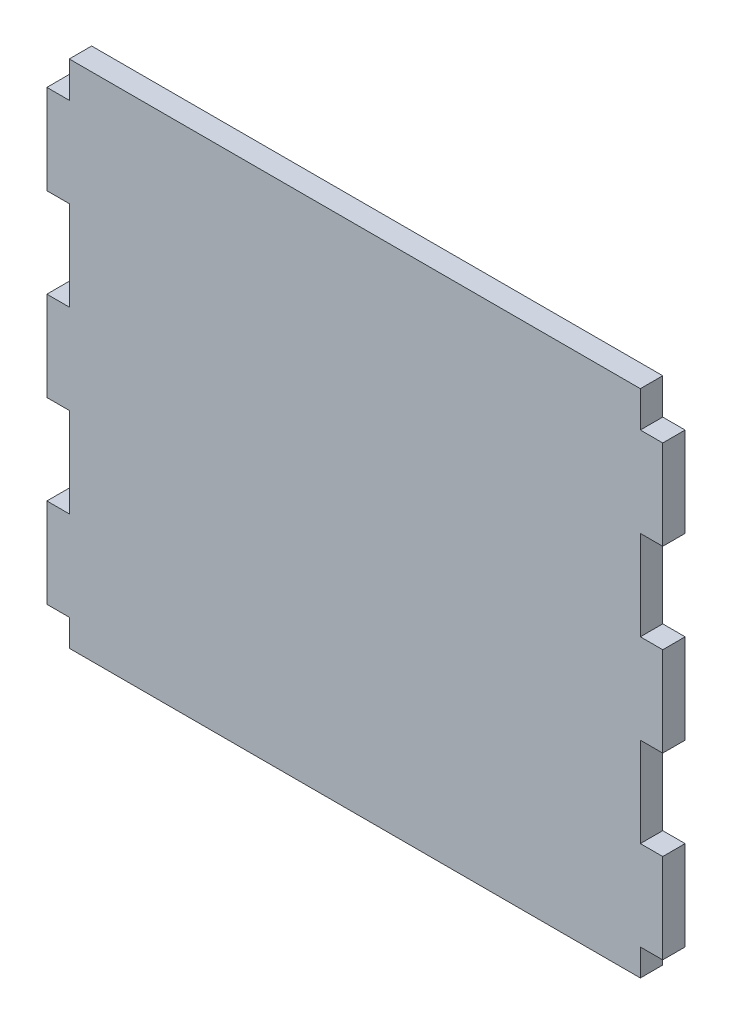
from build123d import *

# Parameters (mm, degrees)
BOSS_EXTRUDE1_DEPTH = 3.175


with BuildPart() as part:
    # Sketch1 → Boss-Extrude1 (new body)
    with BuildSketch(Plane.XY):
        Polygon((0, 5.08), (-3.175, 5.08), (-3.175, 17.78), (0, 17.78), (0, 30.48), (-3.175, 30.48), (-3.175, 43.18), (0, 43.18), (0, 55.88), (-3.175, 55.88), (-3.175, 68.58), (0, 68.58), (0, 73.66), (81, 73.66), (81, 68.58), (84.175, 68.58), (84.175, 55.88), (81, 55.88), (81, 43.18), (84.175, 43.18), (84.175, 30.48), (81, 30.48), (81, 17.78), (84.175, 17.78), (84.175, 5.08), (81, 5.08), (81, 1.27), (0, 1.27), align=None)
    extrude(amount=BOSS_EXTRUDE1_DEPTH)


solid = part.part
